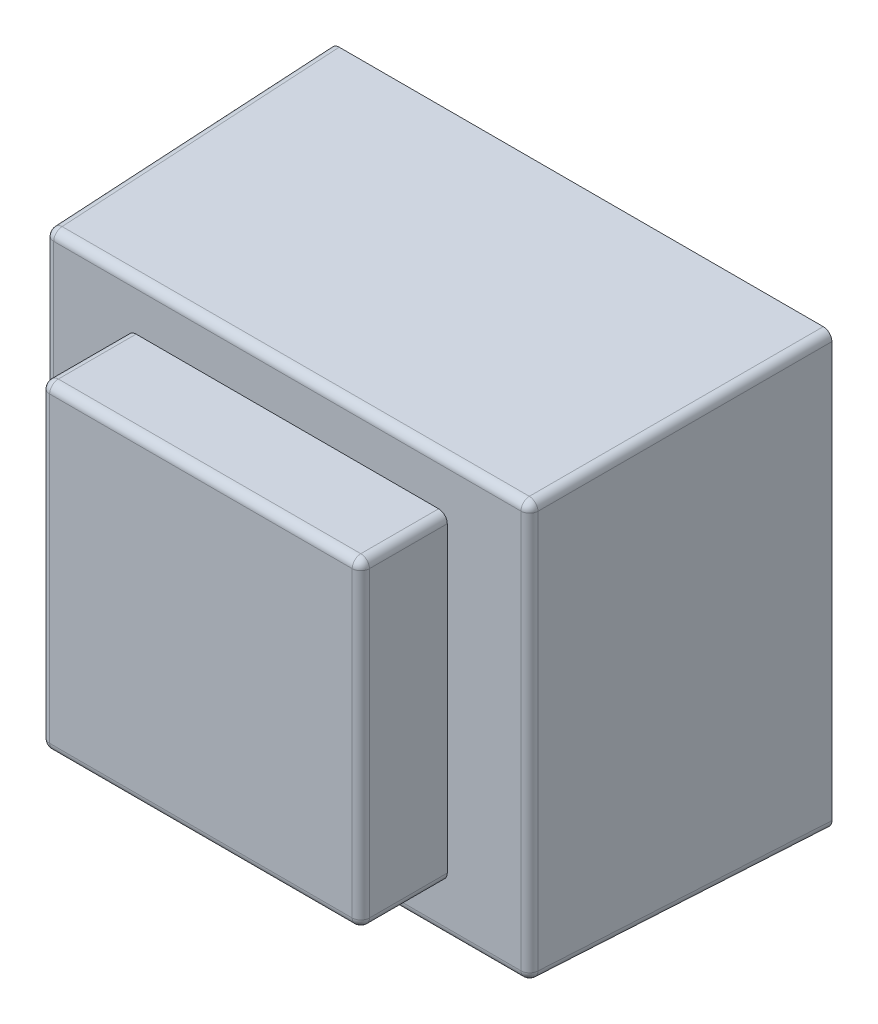
from build123d import *

# Parameters (mm, degrees)
EXTRUDE_3_DEPTH          = 25
CUT_EXTRUDE_1_DEPTH      = 52.205468458
CUT_EXTRUDE_1_DEPTH_BACK = 52.205468458
SKETCH_3_OUTSIDE_W       = 52.758
SKETCH_3_OUTSIDE_H       = 68.758
SKETCH_4_W               = 37
SKETCH_4_H               = 37
EXTRUDE_4_DEPTH          = 10
SKETCH_8_W               = 2.8
SKETCH_8_H               = 2.8
CUT_EXTRUDE_3_DEPTH      = 10
SKETCH_5_W               = 55
SKETCH_5_H               = 47
CUT_EXTRUDE_2_DEPTH      = 0.7
FILLET_1_R               = 1
EXTRUDE_START            = 0.7
SKETCH_7_R               = 0.4
EXTRUDE_5_DEPTH          = 4
EXTRUDE_5_2_DEPTH        = 4
EXTRUDE_5_3_DEPTH        = 4
EXTRUDE_5_4_DEPTH        = 4


with BuildPart() as part:
    # Эскиз1 → Бобышка-Вытянуть3 (new, symmetric)
    with BuildSketch(Plane(origin=(0, 0, 0), x_dir=(1, 0, 0), z_dir=(0, 1, 0))):
        Polygon((-29, 0), (-28, -34), (28, -34), (29, 0), align=None)
    extrude(amount=EXTRUDE_3_DEPTH, both=True)

    # Эскиз3 outside → Вырез-Вытянуть1 (cut, two sides: drawn at the far end of the back side and taken through both)
    with BuildSketch(Plane(origin=(0, 0, 0), x_dir=(0, 0, -1), z_dir=(1, 0, 0)).offset(-CUT_EXTRUDE_1_DEPTH_BACK)):
        with Locations((-17, 0)):
            Rectangle(SKETCH_3_OUTSIDE_W, SKETCH_3_OUTSIDE_H)
        Polygon((0, 25), (-34, 24), (-34, -24), (0, -25), align=None, mode=Mode.SUBTRACT)
    extrude(amount=CUT_EXTRUDE_1_DEPTH + CUT_EXTRUDE_1_DEPTH_BACK, mode=Mode.SUBTRACT)

    # Эскиз4 → Бобышка-Вытянуть4 (add)
    with BuildSketch(Plane.XY.offset(34)):
        Rectangle(SKETCH_4_W, SKETCH_4_H)
    extrude(amount=EXTRUDE_4_DEPTH)

    # Эскиз8 → Вырез-Вытянуть3 (cut)
    with BuildSketch(Plane(origin=(0, 0, 0), x_dir=(1, 0, 0), z_dir=(0, 0, -1))):
        with Locations((22, 0)):
            Rectangle(SKETCH_8_W, SKETCH_8_H)
        with Locations((-22, 0)):
            Rectangle(SKETCH_8_W, SKETCH_8_H)
    extrude(amount=-CUT_EXTRUDE_3_DEPTH, mode=Mode.SUBTRACT)

    # Эскиз5 → Вырез-Вытянуть2 (cut)
    with BuildSketch(Plane(origin=(0, 0, 0), x_dir=(1, 0, 0), z_dir=(0, 0, -1))):
        Rectangle(SKETCH_5_W, SKETCH_5_H)
    extrude(amount=-CUT_EXTRUDE_2_DEPTH, mode=Mode.SUBTRACT)

    # Скругление1
    fillet_1_edges = [part.edges().sort_by_distance(p)[0] for p in [
        (28, 0, 34),
        (-28, 0, 34),
        (0, -24, 34),
        (0, 24, 34),
        (-28.5, 24.5, 17),
        (28.5, 24.5, 17),
        (-28.5, -24.5, 17),
        (28.5, -24.5, 17),
        (18.5, -18.5, 39),
        (18.5, 18.5, 39),
        (-18.5, 18.5, 39),
        (-18.5, -18.5, 39),
        (18.5, 0, 44),
        (0, 18.5, 44),
        (-18.5, 0, 44),
        (0, -18.5, 44),
    ]]
    fillet(fillet_1_edges, radius=FILLET_1_R)


with BuildPart() as body_2:
    # Эскиз7 → Бобышка-Вытянуть5 (new body)
    with BuildSketch(Plane(origin=(0, -0.7, 0.7), x_dir=(1, 0, 0), z_dir=(0, 0, -1)).offset(EXTRUDE_START)):
        with Locations((-15, 15.8)):
            Circle(SKETCH_7_R)
    extrude(amount=EXTRUDE_5_DEPTH)


with BuildPart() as body_3:
    # Эскиз7 → Extrude 5 2 (new body)
    with BuildSketch(Plane(origin=(0, -0.7, 0.7), x_dir=(1, 0, 0), z_dir=(0, 0, -1)).offset(EXTRUDE_START)):
        with Locations((15, 15.8)):
            Circle(SKETCH_7_R)
    extrude(amount=EXTRUDE_5_2_DEPTH)


with BuildPart() as body_4:
    # Эскиз7 → Extrude 5 3 (new body)
    with BuildSketch(Plane(origin=(0, -0.7, 0.7), x_dir=(1, 0, 0), z_dir=(0, 0, -1)).offset(EXTRUDE_START)):
        with Locations((-10, -17.2)):
            Circle(SKETCH_7_R)
    extrude(amount=EXTRUDE_5_3_DEPTH)


with BuildPart() as body_5:
    # Эскиз7 → Extrude 5 4 (new body)
    with BuildSketch(Plane(origin=(0, -0.7, 0.7), x_dir=(1, 0, 0), z_dir=(0, 0, -1)).offset(EXTRUDE_START)):
        with Locations((10, -17.2)):
            Circle(SKETCH_7_R)
    extrude(amount=EXTRUDE_5_4_DEPTH)


solid = Compound([part.part, body_2.part, body_3.part, body_4.part, body_5.part])
